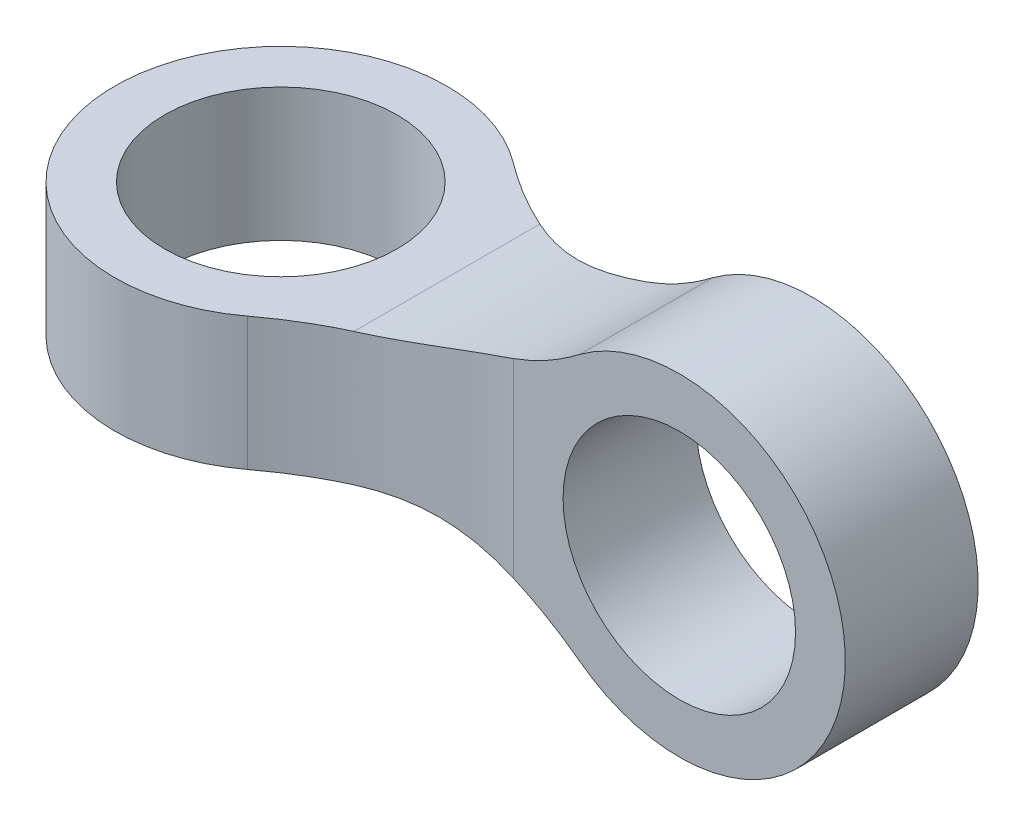
from build123d import *

# Parameters (mm, degrees)
SKETCH1_R               = 35
BOSS_EXTRUDE1_DEPTH     = 60
CUT_EXTRUDE2_DEPTH      = 212.187120971
CUT_EXTRUDE2_DEPTH_BACK = 212.187120971
SKETCH3_OUTSIDE_W       = 299.272
SKETCH3_OUTSIDE_H       = 179.272
SKETCH3_OUTSIDE_R       = 35


with BuildPart() as part:
    # Sketch1 → Boss-Extrude1 (new, symmetric)
    with BuildSketch(Plane(origin=(0, 0, 0), x_dir=(1, 0, 0), z_dir=(0, 1, 0))):
        with BuildLine():
            Line((90, 20), (190, 20))
            Line((190, 20), (190, -20))
            Line((190, -20), (90, -20))
            add(Edge.make_bspline(
                [(30, -40), (53.522105639, -22.358420771), (73.740829121, -19.957299765), (90, -20)],
                knots=[0, 0, 0, 0, 0.5, 0.5, 0.5, 0.5], degree=3))
            ThreePointArc((30, -40), (-50, 0), (30, 40))
            add(Edge.make_bspline(
                [(30, 40), (53.522105639, 22.358420771), (73.740829121, 19.957299765), (90, 20)],
                knots=[0, 0, 0, 0, 0.5, 0.5, 0.5, 0.5], degree=3))
        make_face()
        with Locations(Location((0, 0, 0), (0, 0, 270))):
            Circle(SKETCH1_R, mode=Mode.SUBTRACT)
    extrude(amount=BOSS_EXTRUDE1_DEPTH, both=True)

    # Sketch3 outside → Cut-Extrude2 (cut, two sides: drawn at the far end of the back side and taken through both)
    # profile 1 of 2: a face of its own
    with BuildSketch(Plane(origin=(0, 0, -20), x_dir=(-1, 0, 0), z_dir=(0, 0, -1)).offset(-CUT_EXTRUDE2_DEPTH_BACK)):
        with Locations((-70, 0)):
            Rectangle(SKETCH3_OUTSIDE_W, SKETCH3_OUTSIDE_H)
        with BuildLine():
            Line((-50, -20), (50, -20))
            Line((50, -20), (50, 20))
            Line((50, 20), (-50, 20))
            add(Edge.make_bspline(
                [(-110, 40), (-99.496724582, 32.122543436), (-87.389560029, 27.685973517), (-61.506465559, 20), (-50, 20)],
                knots=[0, 0, 0, 0, 0.549428734, 1, 1, 1, 1], degree=3))
            ThreePointArc((-110, 40), (-190, 0), (-110, -40))
            add(Edge.make_bspline(
                [(-110, -40), (-100.093364528, -32.570023396), (-80.659161516, -23.139318123), (-60.932096988, -20), (-50, -20)],
                knots=[0, 0, 0, 0, 0.546701071, 1, 1, 1, 1], degree=3))
        make_face(mode=Mode.SUBTRACT)
    # profile 2 of 2: a face of its own
    with BuildSketch(Plane(origin=(0, 0, -20), x_dir=(-1, 0, 0), z_dir=(0, 0, -1)).offset(-CUT_EXTRUDE2_DEPTH_BACK)):
        with Locations((-140, 0)):
            Circle(SKETCH3_OUTSIDE_R)
    extrude(amount=CUT_EXTRUDE2_DEPTH + CUT_EXTRUDE2_DEPTH_BACK, mode=Mode.SUBTRACT)


solid = part.part
